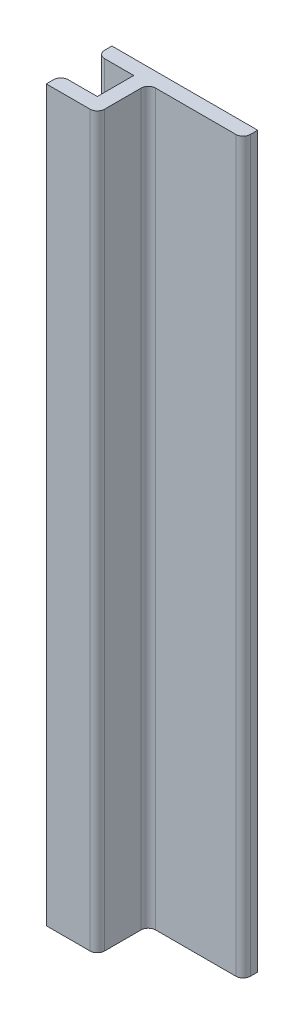
from build123d import *

# Parameters (mm, degrees)
BOSS_EXTRUDE1_DEPTH = 100
FILLET1_R           = 1


with BuildPart() as part:
    # Sketch1 → Boss-Extrude1 (new body)
    with BuildSketch(Plane(origin=(0, 0, 0), x_dir=(1, 0, 0), z_dir=(0, 1, 0))):
        Polygon((0, 0), (20, 0), (20, -2), (7, -2), (7, -9), (0, -9), (0, -7), (5, -7), (5, -2), (0, -2), align=None)
    extrude(amount=BOSS_EXTRUDE1_DEPTH)

    # Fillet1
    fillet1_edges = [part.edges().sort_by_distance(p)[0] for p in [
        (20, 50, 2),
        (7, 50, 2),
        (7, 50, 9),
        (0, 50, 7),
        (0, 50, 2),
    ]]
    fillet(fillet1_edges, radius=FILLET1_R)


solid = part.part
